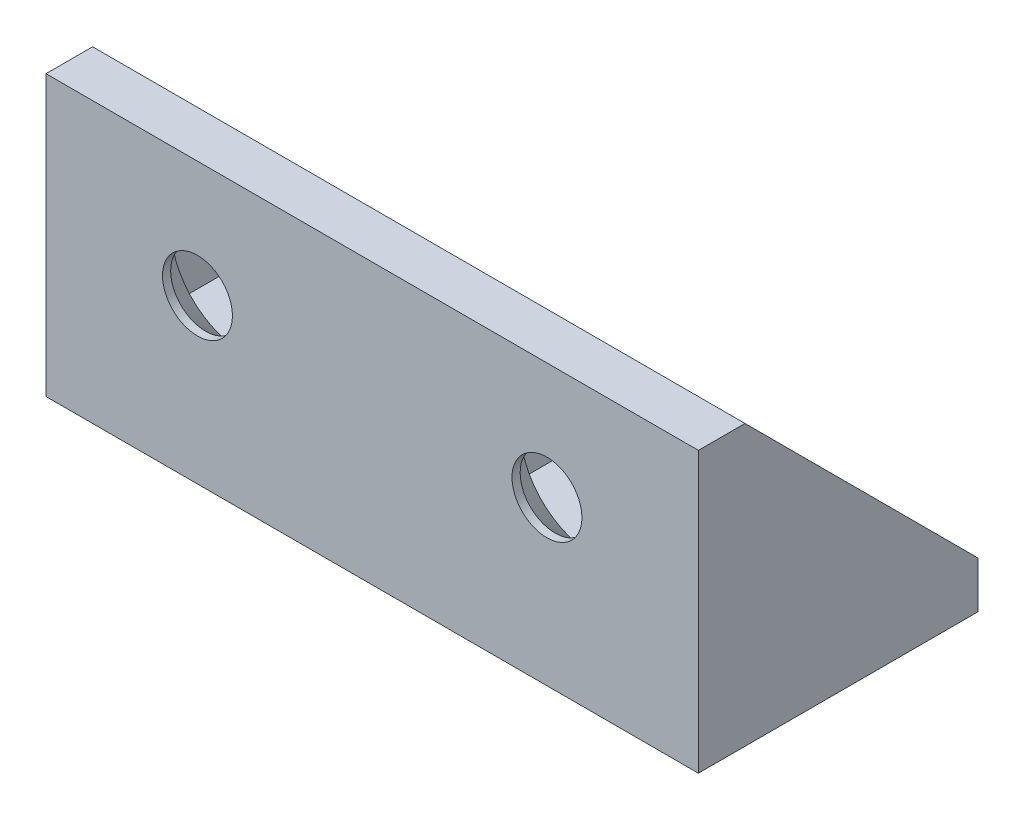
from build123d import *

# Parameters (mm, degrees)
CROQUIS1_R                   = 2.5
SALIENTE_EXTRUIR1_DEPTH      = 4
CROQUIS2_W                   = 50
CROQUIS2_H                   = 4
SALIENTE_EXTRUIR2_DEPTH      = 20
SALIENTE_EXTRUIR3_DEPTH      = 3
SALIENTE_EXTRUIR3_DEPTH_BACK = 53
CROQUIS4_W                   = 23
CROQUIS4_H                   = 20
CORTAR_EXTRUIR1_DEPTH        = 20
CROQUIS5_R                   = 3
CORTAR_EXTRUIR2_DEPTH        = 17
CROQUIS6_R                   = 2.5
CORTAR_EXTRUIR3_DEPTH        = 20


with BuildPart() as part:
    # Croquis1 → Saliente-Extruir1 (new body)
    with BuildSketch(Plane(origin=(0, 0, 0), x_dir=(1, 0, 0), z_dir=(0, 1, 0))):
        Polygon((0, 0), (0, 20), (50, 20), (50, 0), (50, -4), (0, -4), align=None)
        with Locations(Location((10, 10, 0), (0, 0, 270))):
            Circle(CROQUIS1_R, mode=Mode.SUBTRACT)
        with Locations(Location((40, 10, 0), (0, 0, 270))):
            Circle(CROQUIS1_R, mode=Mode.SUBTRACT)
    extrude(amount=SALIENTE_EXTRUIR1_DEPTH)

    # Croquis2 → Saliente-Extruir2 (add)
    with BuildSketch(Plane(origin=(0, 4, 0), x_dir=(1, 0, 0), z_dir=(0, 1, 0))):
        with Locations((25, -2)):
            Rectangle(CROQUIS2_W, CROQUIS2_H)
    extrude(amount=SALIENTE_EXTRUIR2_DEPTH)

    # Croquis3 → Saliente-Extruir3 (add, two sides: drawn at the far end of the back side and taken through both)
    with BuildSketch(Plane.ZY.offset(-SALIENTE_EXTRUIR3_DEPTH_BACK)):
        Polygon((-20, 4), (-20, 0), (4, 0), (4, 24), (0, 24), align=None)
    extrude(amount=SALIENTE_EXTRUIR3_DEPTH + SALIENTE_EXTRUIR3_DEPTH_BACK)

    # Croquis4 → Cortar-Extruir1 (cut)
    with BuildSketch(Plane(origin=(0, 0, -20), x_dir=(-1, 0, 0), z_dir=(0, 0, -1))):
        with Locations((-39, 14)):
            Rectangle(CROQUIS4_W, CROQUIS4_H)
        with Locations((-11, 14)):
            Rectangle(CROQUIS4_W, CROQUIS4_H)
    extrude(amount=-CORTAR_EXTRUIR1_DEPTH, mode=Mode.SUBTRACT)

    # Croquis5 → Cortar-Extruir2 (cut)
    with BuildSketch(Plane(origin=(0, 0, 0), x_dir=(-1, 0, 0), z_dir=(0, 0, -1))):
        with Locations((-40, 14)):
            Circle(CROQUIS5_R)
        with Locations((-10, 14)):
            Circle(CROQUIS5_R)
    extrude(amount=-CORTAR_EXTRUIR2_DEPTH, mode=Mode.SUBTRACT)

    # Croquis6 → Cortar-Extruir3 (cut)
    with BuildSketch(Plane(origin=(0, 4, 0), x_dir=(1, 0, 0), z_dir=(0, 1, 0))):
        with Locations(Location((10, 10, 0), (0, 0, 180))):
            Circle(CROQUIS6_R)
        with Locations(Location((40, 10, 0), (0, 0, 180))):
            Circle(CROQUIS6_R)
    extrude(amount=-CORTAR_EXTRUIR3_DEPTH, mode=Mode.SUBTRACT)

    # Croquis7 → Cortar-Revolución1 (revolve, cut)
    with BuildSketch(Plane.XY.offset(-10), mode=Mode.PRIVATE) as cortar_revoluci_n1_sk:
        Polygon((40, 0.7), (37.5, 0.7), (34.2, 4), (40, 4), align=None)
    revolve(cortar_revoluci_n1_sk.sketch.rotate(Axis((40, 0.7, -10), (0, 1, 0)), 270), axis=Axis((40, 0.7, -10), (0, 1, 0)), mode=Mode.SUBTRACT)

    # Croquis8 → Cortar-Revolución2 (revolve, cut)
    with BuildSketch(Plane.XY.offset(-10), mode=Mode.PRIVATE) as cortar_revoluci_n2_sk:
        Polygon((10, 4), (10, 0.7), (12.5, 0.7), (15.8, 4), align=None)
    revolve(cortar_revoluci_n2_sk.sketch.rotate(Axis((10, 4, -10), (0, -1, 0)), 90), axis=Axis((10, 4, -10), (0, -1, 0)), mode=Mode.SUBTRACT)

    # Croquis9 → Cortar-Revolución3 (revolve, cut)
    with BuildSketch(Plane(origin=(0, 14, 0), x_dir=(1, 0, 0), z_dir=(0, 1, 0)), mode=Mode.PRIVATE) as cortar_revoluci_n3_sk:
        Polygon((40, 0), (40, -3.3), (43, -3.3), (46.3, 0), align=None)
    revolve(cortar_revoluci_n3_sk.sketch.rotate(Axis((40, 14, 0), (0, 0, 1)), 180), axis=Axis((40, 14, 0), (0, 0, 1)), mode=Mode.SUBTRACT)

    # Croquis10 → Cortar-Revolución4 (revolve, cut)
    with BuildSketch(Plane(origin=(0, 14, 0), x_dir=(1, 0, 0), z_dir=(0, 1, 0)), mode=Mode.PRIVATE) as cortar_revoluci_n4_sk:
        Polygon((10, 0), (10, -3.3), (13, -3.3), (16.3, 0), align=None)
    revolve(cortar_revoluci_n4_sk.sketch.rotate(Axis((10, 14, 0), (0, 0, 1)), 180), axis=Axis((10, 14, 0), (0, 0, 1)), mode=Mode.SUBTRACT)


solid = part.part
